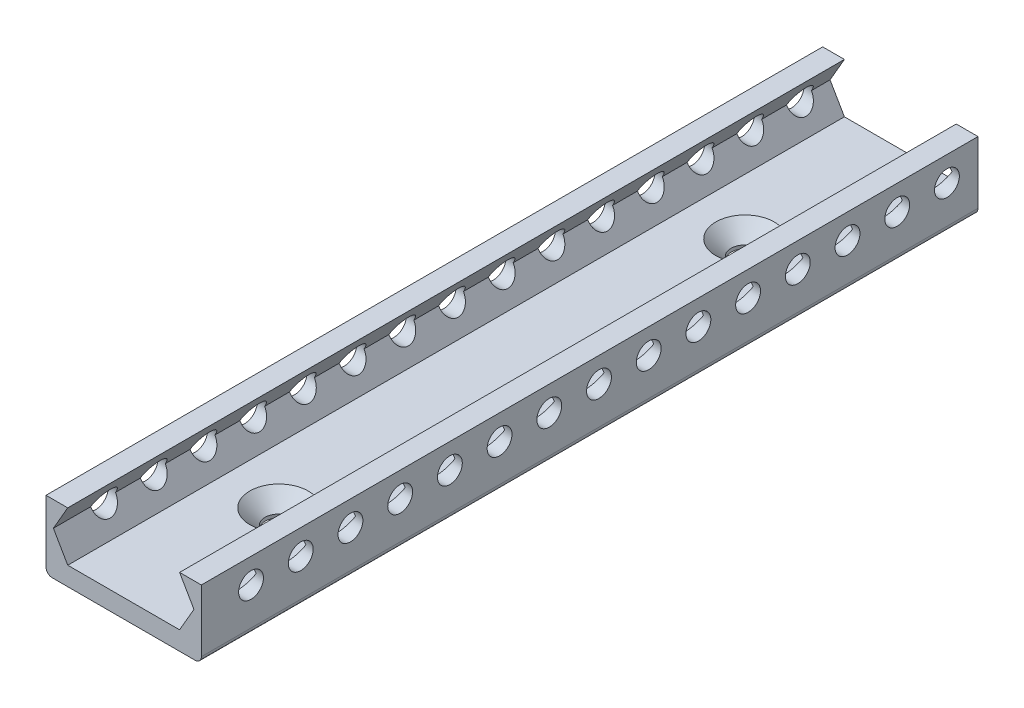
from build123d import *

# Parameters (mm, degrees)
BOSS_EXTRUDE1_DEPTH                            = 125
SKETCH3_R                                      = 2
CUT_EXTRUDE2_DEPTH                             = 100
LPATTERN1_COUNT                                = 28
LPATTERN1_PITCH                                = 8
FILLET1_R                                      = 1
CSK_FOR_M4_FLAT_HEAD_MACHINE_SCREW1_AT_2_COUNT = 2
CSK_FOR_M4_FLAT_HEAD_MACHINE_SCREW1_AT_2_PITCH = 75


with BuildPart() as part:
    # Sketch1 → Boss-Extrude1 (new body)
    with BuildSketch(Plane.XY):
        Polygon((-9, 0), (9, 0), (11.309401077, 4), (9, 8), (12.5, 8), (12.5, -3), (-12.5, -3), (-12.5, 8), (-9, 8), (-11.309401077, 4), align=None)
    extrude(amount=-BOSS_EXTRUDE1_DEPTH)

    # Sketch3 → Cut-Extrude2 (cut)
    with BuildSketch(Plane(origin=(12.5, 0, 0), x_dir=(0, 0, -1), z_dir=(1, 0, 0))):
        with Locations((8, 4)):
            Circle(SKETCH3_R)
    cut_extrude2 = extrude(amount=-CUT_EXTRUDE2_DEPTH, mode=Mode.SUBTRACT)

    # LPattern1: Cut-Extrude2 ×28
    with Locations(*[(0, 0, -i * LPATTERN1_PITCH) for i in range(1, LPATTERN1_COUNT)]):
        add(cut_extrude2, mode=Mode.SUBTRACT)

    # Fillet1
    fillet1_edges = [part.edges().sort_by_distance(p)[0] for p in [
        (12.5, -3, -62.5),
        (-12.5, -3, -62.5),
    ]]
    fillet(fillet1_edges, radius=FILLET1_R)

    # Sketch4 → CSK for M4 Flat Head Machine Screw1 (revolve, cut)
    with BuildSketch(Plane(origin=(0, 0, -100), x_dir=(0, 0, 1), z_dir=(1, 0, 0))):
        Polygon((0, 0), (0, 3), (2.25, 3), (2.25, 2.45), (4.7, 0), align=None)
    csk_for_m4_flat_head_machine_screw1 = revolve(axis=Axis((0, 6.35, -100), (0, -1, 0)), mode=Mode.SUBTRACT)

    # CSK for M4 Flat Head Machine Screw1 at 2: CSK for M4 Flat Head Machine Screw1 ×2
    with Locations(*[(0, 0, i * CSK_FOR_M4_FLAT_HEAD_MACHINE_SCREW1_AT_2_PITCH) for i in range(1, CSK_FOR_M4_FLAT_HEAD_MACHINE_SCREW1_AT_2_COUNT)]):
        add(csk_for_m4_flat_head_machine_screw1, mode=Mode.SUBTRACT)


solid = part.part
